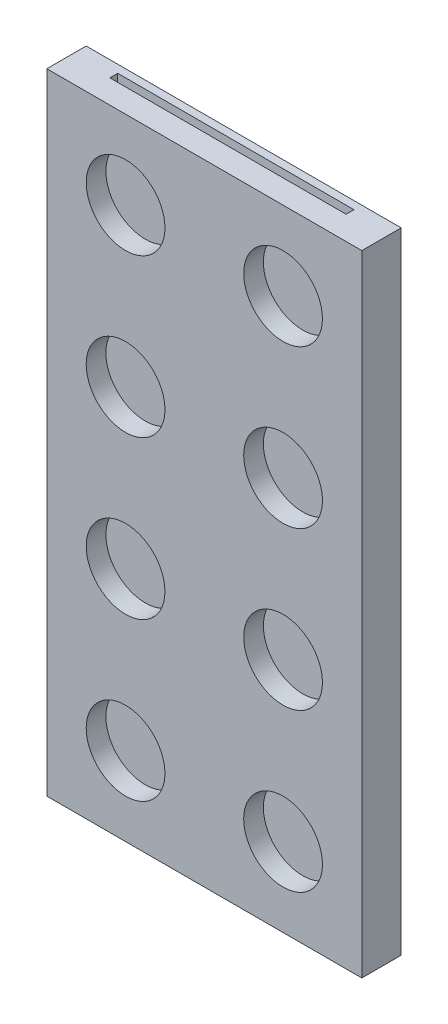
from build123d import *

# Parameters (mm, degrees)
SKETCH1_W           = 50.8
SKETCH1_H           = 101.6
BOSS_EXTRUDE1_DEPTH = 6.35
SKETCH3_R           = 6.35
SKETCH3_R_2         = 2.54
CUT_EXTRUDE2_DEPTH  = 3.175
SKETCH4_W           = 38.1
SKETCH4_H           = 88.9
CUT_EXTRUDE3_DEPTH  = 2.54
CUT_EXTRUDE4_REACH  = 115.77
SKETCH5_W           = 38.1
SKETCH5_H           = 1.27


with BuildPart() as part:
    # Sketch1 → Boss-Extrude1 (new body)
    with BuildSketch(Plane.XY):
        with Locations((25.4, 50.8)):
            Rectangle(SKETCH1_W, SKETCH1_H)
    extrude(amount=BOSS_EXTRUDE1_DEPTH)

    # Sketch3 → Cut-Extrude2 (cut)
    with BuildSketch(Plane.XY.offset(6.35)):
        with Locations((12.7, 139.7)):
            Circle(SKETCH3_R)
        with Locations((38.1, 139.7)):
            Circle(SKETCH3_R)
        with Locations((63.5, 139.7)):
            Circle(SKETCH3_R_2)
        with Locations((88.9, 139.7)):
            Circle(SKETCH3_R_2)
        with Locations((88.9, 114.3)):
            Circle(SKETCH3_R_2)
        with Locations((63.5, 114.3)):
            Circle(SKETCH3_R_2)
        with Locations((38.1, 114.3)):
            Circle(SKETCH3_R)
        with Locations((12.7, 114.3)):
            Circle(SKETCH3_R)
        with Locations((88.9, 88.9)):
            Circle(SKETCH3_R_2)
        with Locations((63.5, 88.9)):
            Circle(SKETCH3_R_2)
        with Locations((38.1, 88.9)):
            Circle(SKETCH3_R)
        with Locations((12.7, 88.9)):
            Circle(SKETCH3_R)
        with Locations((88.9, 63.5)):
            Circle(SKETCH3_R_2)
        with Locations((63.5, 63.5)):
            Circle(SKETCH3_R_2)
        with Locations(Location((38.1, 63.5, 0), (0, 0, 180))):
            Circle(SKETCH3_R)
        with Locations(Location((12.7, 63.5, 0), (0, 0, 180))):
            Circle(SKETCH3_R)
        with Locations((88.9, 38.1)):
            Circle(SKETCH3_R_2)
        with Locations((63.5, 38.1)):
            Circle(SKETCH3_R_2)
        with Locations((38.1, 38.1)):
            Circle(SKETCH3_R)
        with Locations((12.7, 38.1)):
            Circle(SKETCH3_R)
        with Locations((88.9, 12.7)):
            Circle(SKETCH3_R_2)
        with Locations((63.5, 12.7)):
            Circle(SKETCH3_R_2)
        with Locations(Location((38.1, 12.7, 0), (0, 0, 180))):
            Circle(SKETCH3_R)
        with Locations(Location((12.7, 12.7, 0), (0, 0, 180))):
            Circle(SKETCH3_R)
    extrude(amount=-CUT_EXTRUDE2_DEPTH, mode=Mode.SUBTRACT)

    # Sketch4 → Cut-Extrude3 (cut)
    with BuildSketch(Plane(origin=(0, 0, 0), x_dir=(-1, 0, 0), z_dir=(0, 0, -1))):
        with Locations((-25.4, 50.8)):
            Rectangle(SKETCH4_W, SKETCH4_H)
    extrude(amount=-CUT_EXTRUDE3_DEPTH, mode=Mode.SUBTRACT)

    # Sketch5 → Cut-Extrude4 (cut, up to next)
    with BuildSketch(Plane(origin=(0, 101.6, 0), x_dir=(1, 0, 0), z_dir=(0, 1, 0)), mode=Mode.PRIVATE) as cut_extrude4_sk1:
        with Locations((25.4, -1.905)):
            Rectangle(SKETCH5_W, SKETCH5_H)
    cut_extrude4_tool1 = extrude(cut_extrude4_sk1.sketch, amount=-CUT_EXTRUDE4_REACH, mode=Mode.PRIVATE) & part.part
    add(cut_extrude4_tool1.solids().sort_by_distance((25.4, 101.6, 1.905))[0], mode=Mode.SUBTRACT)


solid = part.part
